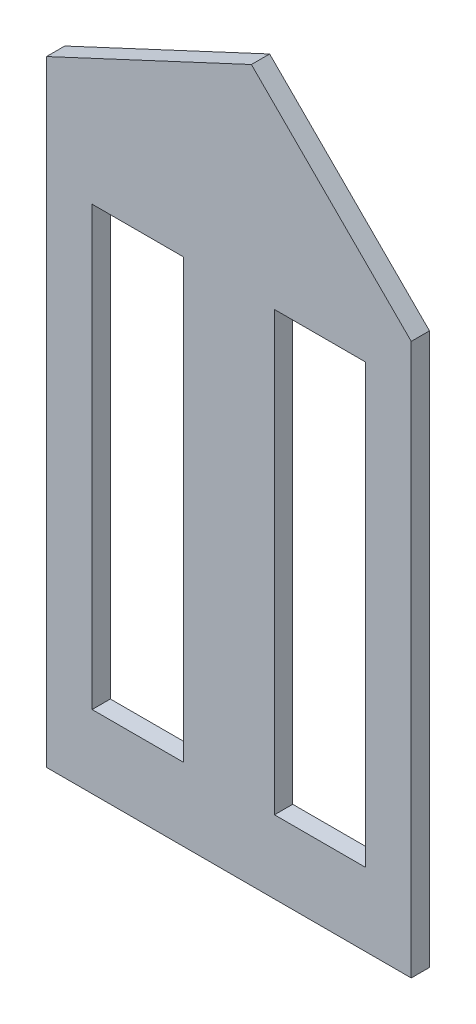
from build123d import *

# Parameters (mm, degrees)
SKETCH1_W           = 127
SKETCH1_H           = 247.65
BOSS_EXTRUDE1_DEPTH = 6.35
CUT_EXTRUDE1_DEPTH  = 279.387939753
SKETCH3_W           = 31.75
SKETCH3_H           = 152.4
CUT_EXTRUDE2_DEPTH  = 279.387939753


with BuildPart() as part:
    # Sketch1 → Boss-Extrude1 (new body)
    with BuildSketch(Plane.XY):
        with Locations((63.5, 123.825)):
            Rectangle(SKETCH1_W, SKETCH1_H)
    extrude(amount=BOSS_EXTRUDE1_DEPTH)

    # Sketch2 → Cut-Extrude1 (cut, through all)
    with BuildSketch(Plane.XY.offset(6.35)):
        Polygon((0, 214.383772574), (71.339654933, 247.65), (0, 247.65), align=None)
        Polygon((127, 247.65), (71.339654933, 247.65), (127, 191.989654933), align=None)
    extrude(amount=-CUT_EXTRUDE1_DEPTH, mode=Mode.SUBTRACT)

    # Sketch3 → Cut-Extrude2 (cut, through all)
    with BuildSketch(Plane.XY.offset(6.35)):
        with Locations((31.75, 101.6)):
            Rectangle(SKETCH3_W, SKETCH3_H)
        with Locations((95.25, 101.6)):
            Rectangle(SKETCH3_W, SKETCH3_H)
    extrude(amount=-CUT_EXTRUDE2_DEPTH, mode=Mode.SUBTRACT)


solid = part.part
